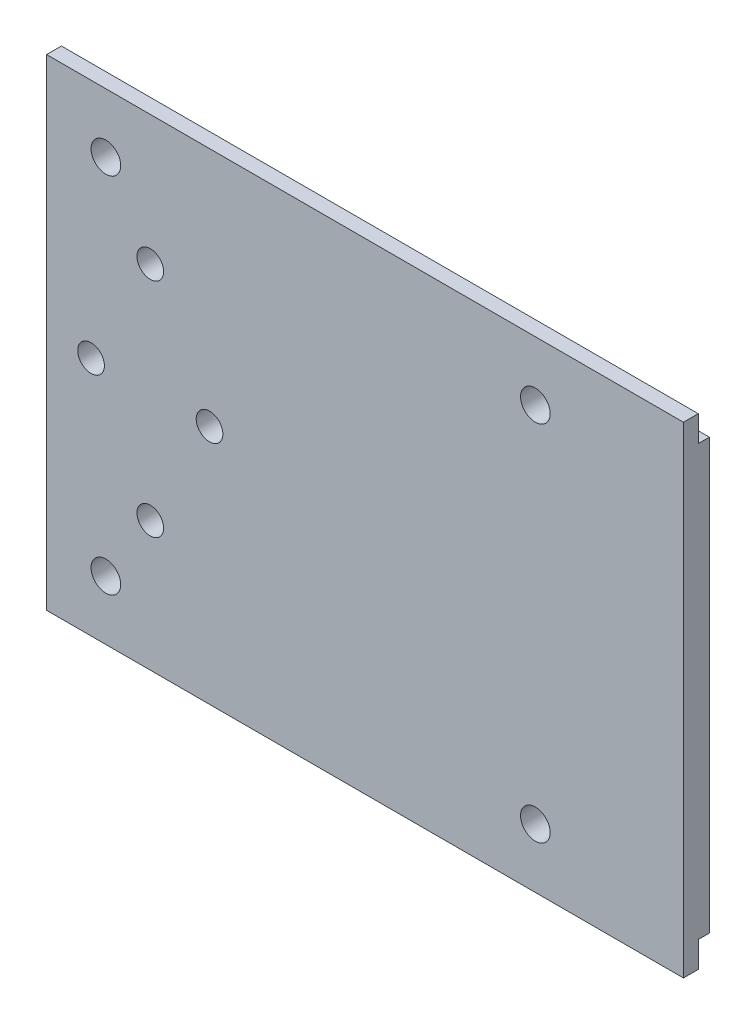
from build123d import *

# Parameters (mm, degrees)
SKETCH1_W           = 82.5
SKETCH1_H           = 58
BOSS_EXTRUDE1_DEPTH = 1.5
SKETCH2_W           = 86
SKETCH2_H           = 65
BOSS_EXTRUDE2_DEPTH = 2
SKETCH3_R           = 2
CUT_EXTRUDE1_DEPTH  = 60.736923255
SKETCH4_R           = 1.8
CUT_EXTRUDE2_DEPTH  = 60.736923255
SKETCH5_R           = 4
CUT_EXTRUDE3_DEPTH  = 0.5


with BuildPart() as part:
    # Sketch1 → Boss-Extrude1 (new body)
    with BuildSketch(Plane.XY):
        with Locations((-5.25, 0)):
            Rectangle(SKETCH1_W, SKETCH1_H)
    extrude(amount=-BOSS_EXTRUDE1_DEPTH)

    # Sketch2 → Boss-Extrude2 (add)
    with BuildSketch(Plane.XY):
        with Locations((-7, 0)):
            Rectangle(SKETCH2_W, SKETCH2_H)
    extrude(amount=BOSS_EXTRUDE2_DEPTH)

    # Sketch3 → Cut-Extrude1 (cut, through all)
    with BuildSketch(Plane.XY.offset(2)):
        with Locations((-42, 24.5)):
            Circle(SKETCH3_R)
        with Locations((16, 24.5)):
            Circle(SKETCH3_R)
        with Locations((16, -24.5)):
            Circle(SKETCH3_R)
        with Locations((-42, -24.5)):
            Circle(SKETCH3_R)
    extrude(amount=-CUT_EXTRUDE1_DEPTH, mode=Mode.SUBTRACT)

    # Sketch4 → Cut-Extrude2 (cut, through all)
    with BuildSketch(Plane.XY.offset(2)):
        with Locations((-44, 0)):
            Circle(SKETCH4_R)
        with Locations((-28, 0)):
            Circle(SKETCH4_R)
        with Locations((-36, 15)):
            Circle(SKETCH4_R)
        with Locations((-36, -15)):
            Circle(SKETCH4_R)
    extrude(amount=-CUT_EXTRUDE2_DEPTH, mode=Mode.SUBTRACT)

    # Sketch5 → Cut-Extrude3 (cut)
    with BuildSketch(Plane(origin=(0, 0, -1.5), x_dir=(-1, 0, 0), z_dir=(0, 0, -1))):
        with Locations((-16, 24.5)):
            Circle(SKETCH5_R)
        with Locations((-16, -24.5)):
            Circle(SKETCH5_R)
        with Locations((42, -24.5)):
            Circle(SKETCH5_R)
        with Locations((42, 24.5)):
            Circle(SKETCH5_R)
    extrude(amount=-CUT_EXTRUDE3_DEPTH, mode=Mode.SUBTRACT)


solid = part.part
